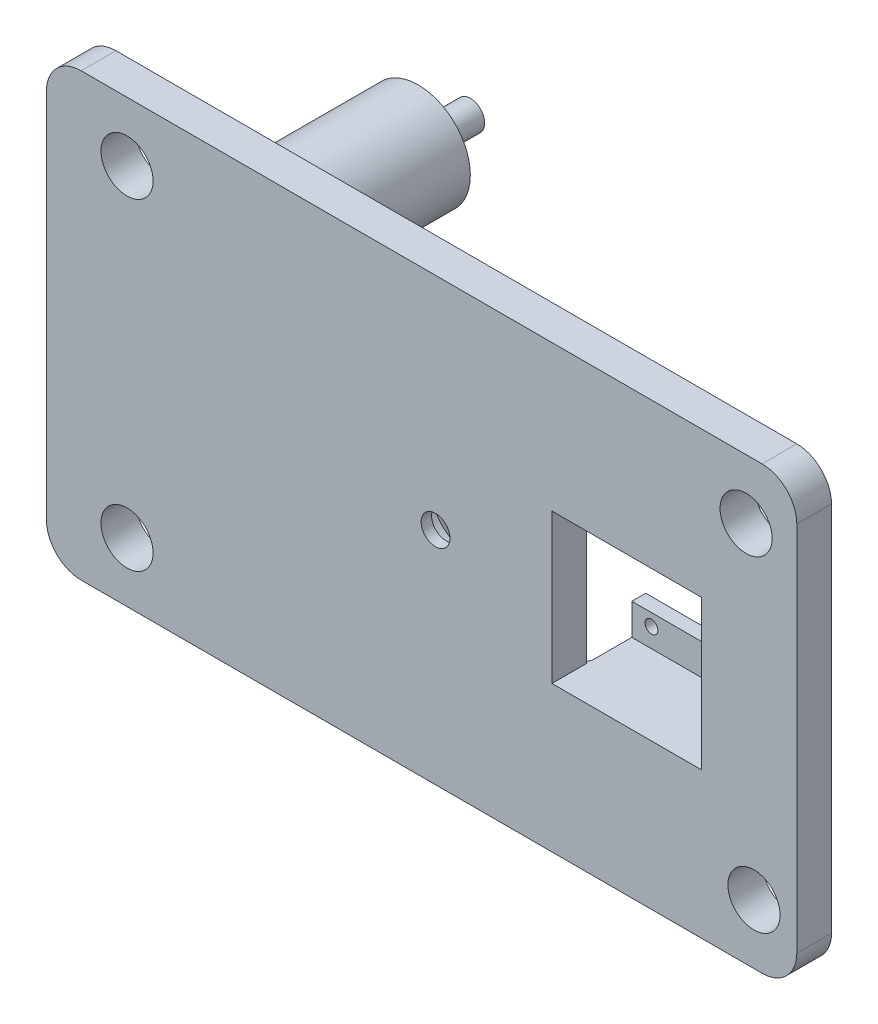
from build123d import *

# Parameters (mm, degrees)
SKETCH1_W            = 216
SKETCH1_H            = 127
BOSS_EXTRUDE1_DEPTH  = 10
FILLET1_R            = 10
FILLET2_R            = 10
SKETCH9_R            = 11.35
CUT_EXTRUDE4_DEPTH   = 7
SKETCH12_R           = 4.15
CUT_EXTRUDE5_DEPTH   = 7
SKETCH9_4_W          = 43
SKETCH9_4_H          = 43
CUT_EXTRUDE6_DEPTH   = 126.683133315
SKETCH13_W           = 43
SKETCH13_H           = 4
BOSS_EXTRUDE2_DEPTH  = 17
FILLET4_R            = 2
SKETCH17_W           = 43
SKETCH17_H           = 4
BOSS_EXTRUDE5_DEPTH  = 9
SKETCH18_W           = 43
SKETCH18_H           = 4
BOSS_EXTRUDE6_DEPTH  = 17
SKETCH19_W           = 43
SKETCH19_H           = 4
BOSS_EXTRUDE7_DEPTH  = 9
FILLET5_R            = 2
SKETCH20_R           = 1.85
CUT_EXTRUDE7_DEPTH   = 9
SKETCH23_R           = 1.85
CUT_EXTRUDE8_DEPTH   = 9
SKETCH25_R           = 15
BOSS_EXTRUDE9_DEPTH  = 40
SKETCH26_R           = 4.15
BOSS_EXTRUDE10_DEPTH = 15
SKETCH27_R           = 4.15
BOSS_EXTRUDE11_DEPTH = 15
FILLET9_R            = 2
FILLET10_R           = 2
SKETCH28_R           = 7.5
CUT_EXTRUDE9_DEPTH   = 142.142658328


with BuildPart() as part:
    # Sketch1 → Boss-Extrude1 (new body)
    with BuildSketch(Plane.XY):
        Rectangle(SKETCH1_W, SKETCH1_H)
    extrude(amount=BOSS_EXTRUDE1_DEPTH)

    # Fillet1
    fillet1_edges = [part.edges().sort_by_distance(p)[0] for p in [
        (-108, 63.5, 5),
    ]]
    fillet(fillet1_edges, radius=FILLET1_R)

    # Fillet2
    fillet2_edges = [part.edges().sort_by_distance(p)[0] for p in [
        (-108, -63.5, 5),
        (108, 63.5, 5),
        (108, -63.5, 5),
    ]]
    fillet(fillet2_edges, radius=FILLET2_R)

    # Sketch9 → Cut-Extrude4 (cut)
    with BuildSketch(Plane(origin=(0, 0, 0), x_dir=(-1, 0, 0), z_dir=(0, 0, -1))):
        with Locations((-4, 0)):
            Circle(SKETCH9_R)
    extrude(amount=-CUT_EXTRUDE4_DEPTH, mode=Mode.SUBTRACT)

    # Sketch12 → Cut-Extrude5 (cut)
    with BuildSketch(Plane(origin=(0, 0, 7), x_dir=(-1, 0, 0), z_dir=(0, 0, -1))):
        with Locations((-4, 0)):
            Circle(SKETCH12_R)
    extrude(amount=-CUT_EXTRUDE5_DEPTH, mode=Mode.SUBTRACT)

    # Sketch9<4> → Cut-Extrude6 (cut, through all)
    with BuildSketch(Plane(origin=(0, 0, 0), x_dir=(-1, 0, 0), z_dir=(0, 0, -1))):
        with Locations((-59, 0)):
            Rectangle(SKETCH9_4_W, SKETCH9_4_H)
    extrude(amount=-CUT_EXTRUDE6_DEPTH, mode=Mode.SUBTRACT)

    # Sketch13 → Boss-Extrude2 (add)
    with BuildSketch(Plane(origin=(0, 0, 0), x_dir=(-1, 0, 0), z_dir=(0, 0, -1))):
        with Locations((-59, -23.5)):
            Rectangle(SKETCH13_W, SKETCH13_H)
    extrude(amount=BOSS_EXTRUDE2_DEPTH)

    # Fillet4
    fillet4_edges = [part.edges().sort_by_distance(p)[0] for p in [
        (59, -25.5, 0),
        (37.5, -23.5, 0),
        (80.5, -23.5, 0),
    ]]
    fillet(fillet4_edges, radius=FILLET4_R)

    # Sketch17 → Boss-Extrude5 (add)
    with BuildSketch(Plane(origin=(0, -21.5, 0), x_dir=(1, 0, 0), z_dir=(0, 1, 0))):
        with Locations((59, 15)):
            Rectangle(SKETCH17_W, SKETCH17_H)
    extrude(amount=BOSS_EXTRUDE5_DEPTH)

    # Sketch18 → Boss-Extrude6 (add)
    with BuildSketch(Plane(origin=(0, 0, 0), x_dir=(-1, 0, 0), z_dir=(0, 0, -1))):
        with Locations((-59, 23.5)):
            Rectangle(SKETCH18_W, SKETCH18_H)
    extrude(amount=BOSS_EXTRUDE6_DEPTH)

    # Sketch19 → Boss-Extrude7 (add)
    with BuildSketch(Plane(origin=(0, 21.5, 0), x_dir=(-1, 0, 0), z_dir=(0, -1, 0))):
        with Locations((-59, 15)):
            Rectangle(SKETCH19_W, SKETCH19_H)
    extrude(amount=BOSS_EXTRUDE7_DEPTH)

    # Fillet5
    fillet5_edges = [part.edges().sort_by_distance(p)[0] for p in [
        (37.5, 23.5, 0),
        (80.5, 23.5, 0),
        (59, 25.5, 0),
    ]]
    fillet(fillet5_edges, radius=FILLET5_R)

    # Sketch20 → Cut-Extrude7 (cut)
    with BuildSketch(Plane(origin=(0, 0, -17), x_dir=(-1, 0, 0), z_dir=(0, 0, -1))):
        with Locations((-43.15, -16)):
            Circle(SKETCH20_R)
        with Locations((-74.85, -16)):
            Circle(SKETCH20_R)
    extrude(amount=-CUT_EXTRUDE7_DEPTH, mode=Mode.SUBTRACT)

    # Sketch23 → Cut-Extrude8 (cut)
    with BuildSketch(Plane(origin=(0, 0, -17), x_dir=(-1, 0, 0), z_dir=(0, 0, -1))):
        with Locations((-43.15, 15.85)):
            Circle(SKETCH23_R)
        with Locations((-74.85, 16)):
            Circle(SKETCH23_R)
    extrude(amount=-CUT_EXTRUDE8_DEPTH, mode=Mode.SUBTRACT)

    # Sketch25 → Boss-Extrude9 (add)
    with BuildSketch(Plane(origin=(0, 0, 0), x_dir=(-1, 0, 0), z_dir=(0, 0, -1))):
        with Locations((50.981638517, -43.5)):
            Circle(SKETCH25_R)
        with Locations((50.981638517, 43.5)):
            Circle(SKETCH25_R)
    extrude(amount=BOSS_EXTRUDE9_DEPTH)

    # Sketch26 → Boss-Extrude10 (add)
    with BuildSketch(Plane(origin=(0, 0, -40), x_dir=(-1, 0, 0), z_dir=(0, 0, -1))):
        with Locations((50.981638517, -43.5)):
            Circle(SKETCH26_R)
    extrude(amount=BOSS_EXTRUDE10_DEPTH)

    # Sketch27 → Boss-Extrude11 (add)
    with BuildSketch(Plane(origin=(0, 0, -40), x_dir=(-1, 0, 0), z_dir=(0, 0, -1))):
        with Locations((50.981638517, 43.5)):
            Circle(SKETCH27_R)
    extrude(amount=BOSS_EXTRUDE11_DEPTH)

    # Fillet9
    fillet9_edges = [part.edges().sort_by_distance(p)[0] for p in [
        (-35.981638517, -43.5, 0),
    ]]
    fillet(fillet9_edges, radius=FILLET9_R)

    # Fillet10
    fillet10_edges = [part.edges().sort_by_distance(p)[0] for p in [
        (-35.981638517, 43.5, 0),
    ]]
    fillet(fillet10_edges, radius=FILLET10_R)

    # Sketch28 → Cut-Extrude9 (cut, through all)
    with BuildSketch(Plane.XY.offset(10)):
        with Locations((-84.811667967, 46.37)):
            Circle(SKETCH28_R)
        with Locations((-84.811667967, -46.37)):
            Circle(SKETCH28_R)
        with Locations((95.674047271, -46.369786546)):
            Circle(SKETCH28_R)
        with Locations((93.399057455, 46.37)):
            Circle(SKETCH28_R)
    extrude(amount=-CUT_EXTRUDE9_DEPTH, mode=Mode.SUBTRACT)


solid = part.part
